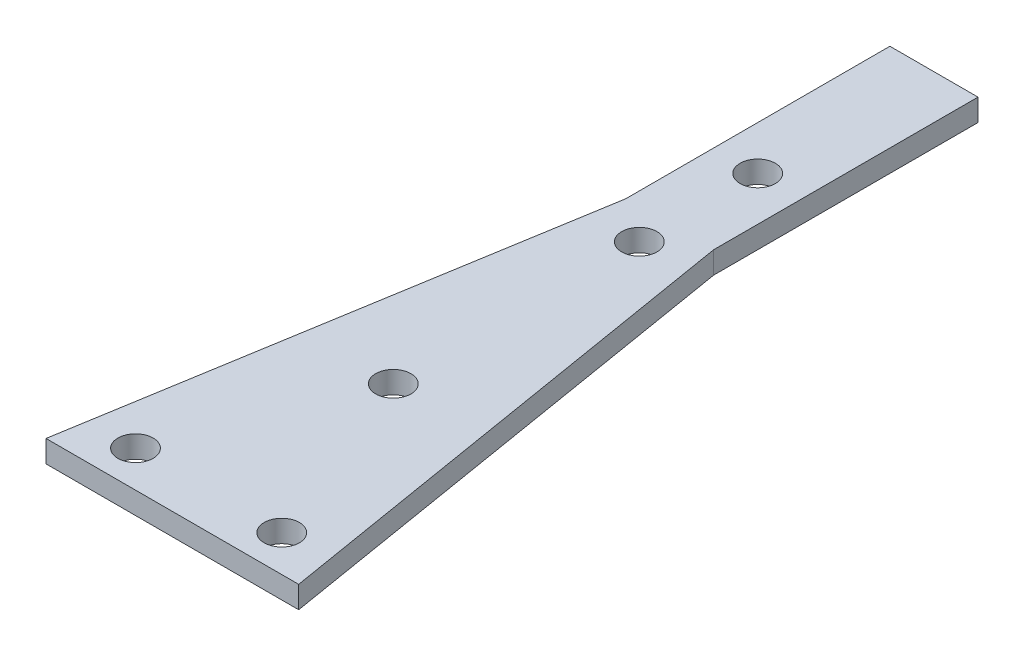
from build123d import *

# Parameters (mm, degrees)
SKETCH1_R           = 2.54
SKETCH1_W           = 12.7
SKETCH1_H           = 38.1
BOSS_EXTRUDE1_DEPTH = 3.175
SKETCH4_R           = 2.54
CUT_EXTRUDE2_DEPTH  = 25.4


with BuildPart() as part:
    # Sketch1 → Boss-Extrude1 (new body)
    # profile 1 of 3: a face of its own
    with BuildSketch(Plane(origin=(0, 0, 0), x_dir=(1, 0, 0), z_dir=(0, 1, 0))):
        Polygon((0.840595698, 5.08), (19.05, 5.08), (37.259404302, 5.08), (30.48, 46.0502), (7.62, 46.0502), align=None)
        with Locations(Location((8.509, 10.3124, 0), (0, 0, 270))):
            Circle(SKETCH1_R, mode=Mode.SUBTRACT)
        with Locations(Location((29.591, 10.3124, 0), (0, 0, 270))):
            Circle(SKETCH1_R, mode=Mode.SUBTRACT)
        with Locations(Location((19.05, 36.9316, 0), (0, 0, 270))):
            Circle(SKETCH1_R, mode=Mode.SUBTRACT)
    # profile 2 of 3: a face of its own
    with BuildSketch(Plane(origin=(0, 0, 0), x_dir=(1, 0, 0), z_dir=(0, 1, 0))):
        Polygon((12.7, 76.750333333), (7.62, 46.0502), (30.48, 46.0502), (25.4, 76.750333333), align=None)
    # profile 3 of 3: a face of its own
    with BuildSketch(Plane(origin=(0, 0, 0), x_dir=(1, 0, 0), z_dir=(0, 1, 0))):
        with Locations((19.05, 95.800333333)):
            Rectangle(SKETCH1_W, SKETCH1_H)
    extrude(amount=BOSS_EXTRUDE1_DEPTH)

    # Sketch4 → Cut-Extrude2 (cut)
    with BuildSketch(Plane.XZ):
        with Locations(Location((19.05, -72.39, 0), (0, 0, 270))):
            Circle(SKETCH4_R)
        with Locations(Location((19.05, -89.450333333, 0), (0, 0, 270))):
            Circle(SKETCH4_R)
    extrude(amount=-CUT_EXTRUDE2_DEPTH, mode=Mode.SUBTRACT)


solid = part.part
